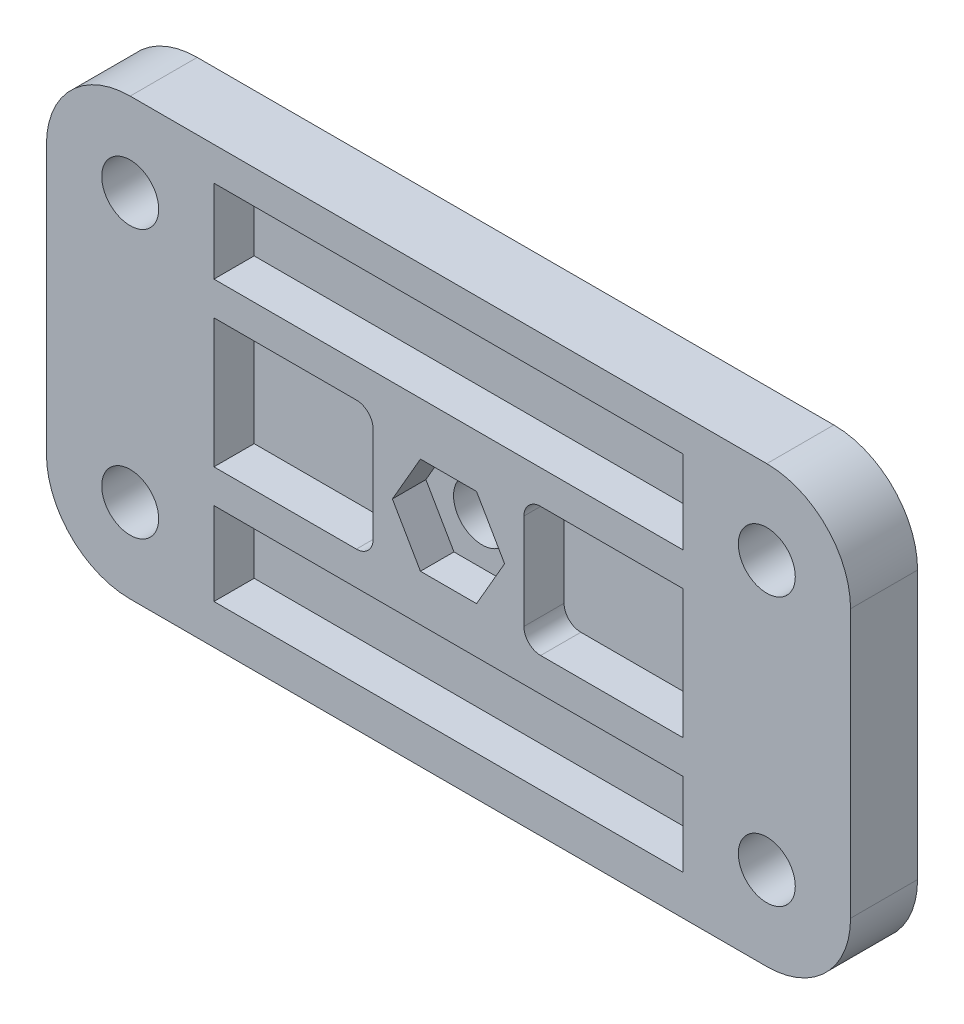
from build123d import *

# Parameters (mm, degrees)
SKETCH1_R           = 1.7
BOSS_EXTRUDE1_DEPTH = 4
CUT_EXTRUDE1_DEPTH  = 2
SKETCH3_W           = 28
SKETCH3_H           = 4.960661027
SKETCH3_W_2         = 9.5
SKETCH3_H_2         = 7.70604726
SKETCH3_H_3         = 4.960661028
CUT_EXTRUDE2_DEPTH  = 2.4
FILLET1_R           = 1


with BuildPart() as part:
    # Sketch1 → Boss-Extrude1 (new body)
    with BuildSketch(Plane.XY):
        with BuildLine():
            Line((-19, -13), (19, -13))
            ThreePointArc((19, -13), (22.535533906, -11.535533906), (24, -8))
            Line((24, -8), (24, 8))
            ThreePointArc((24, 8), (22.535533906, 11.535533906), (19, 13))
            Line((19, 13), (-19, 13))
            ThreePointArc((-19, 13), (-22.535533906, 11.535533906), (-24, 8))
            Line((-24, 8), (-24, -8))
            ThreePointArc((-24, -8), (-22.535533906, -11.535533906), (-19, -13))
        make_face()
        Circle(SKETCH1_R, mode=Mode.SUBTRACT)
        with Locations((19, 8)):
            Circle(SKETCH1_R, mode=Mode.SUBTRACT)
        with Locations((19, -8)):
            Circle(SKETCH1_R, mode=Mode.SUBTRACT)
        with Locations((-19, -8)):
            Circle(SKETCH1_R, mode=Mode.SUBTRACT)
        with Locations((-19, 8)):
            Circle(SKETCH1_R, mode=Mode.SUBTRACT)
    extrude(amount=BOSS_EXTRUDE1_DEPTH)

    # Sketch2 → Cut-Extrude1 (cut)
    with BuildSketch(Plane.XY.offset(4)):
        Polygon((3.348631561, 0), (1.674315781, 2.9), (-1.674315781, 2.9), (-3.348631561, 0), (-1.674315781, -2.9), (1.674315781, -2.9), align=None)
    extrude(amount=-CUT_EXTRUDE1_DEPTH, mode=Mode.SUBTRACT)

    # Sketch3 → Cut-Extrude2 (cut)
    with BuildSketch(Plane.XY.offset(4)):
        with Locations((0, 8.519669486)):
            Rectangle(SKETCH3_W, SKETCH3_H)
        with Locations((-9.25, 0.186315343)):
            Rectangle(SKETCH3_W_2, SKETCH3_H_2)
        with Locations((9.25, 0.186315343)):
            Rectangle(SKETCH3_W_2, SKETCH3_H_2)
        with Locations((0, -8.147038801)):
            Rectangle(SKETCH3_W, SKETCH3_H_3)
    extrude(amount=-CUT_EXTRUDE2_DEPTH, mode=Mode.SUBTRACT)

    # Fillet1
    fillet1_edges = [part.edges().sort_by_distance(p)[0] for p in [
        (-4.5, 4.039338973, 2.8),
        (-4.5, -3.666708287, 2.8),
        (4.5, -3.666708287, 2.8),
        (4.5, 4.039338973, 2.8),
    ]]
    fillet(fillet1_edges, radius=FILLET1_R)


solid = part.part
